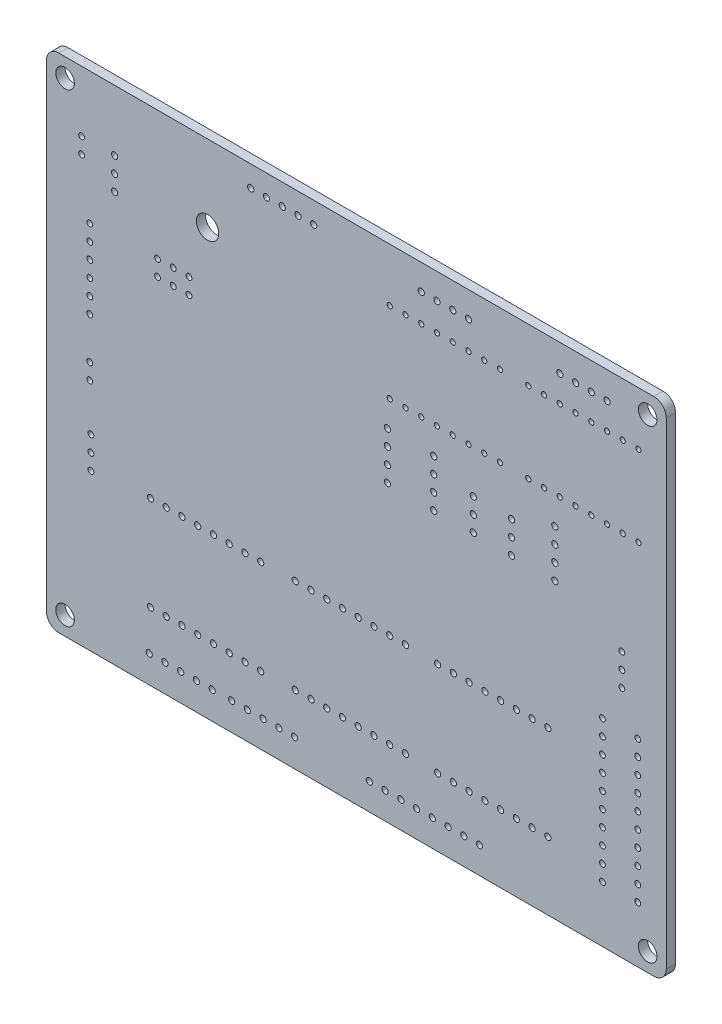
from build123d import *

# Parameters (mm, degrees)
SKETCH2_R           = 1.5
SKETCH2_R_2         = 1.8034
SKETCH2_R_3         = 0.5
SKETCH2_R_4         = 0.4699
SKETCH2_R_5         = 0.498751149
SKETCH2_R_6         = 0.4191
SKETCH2_R_7         = 0.501468592
BOSS_EXTRUDE1_DEPTH = 0.75


with BuildPart() as part:
    # Sketch2 → Boss-Extrude1 (new, symmetric)
    with BuildSketch(Plane.XY):
        with BuildLine():
            Line((0, 2), (0, 79))
            ThreePointArc((0, 79), (0.5858, 80.4142), (2, 81))
            Line((2, 81), (98, 81))
            ThreePointArc((98, 81), (99.4142, 80.4142), (100, 79))
            Line((100, 79), (100, 2))
            ThreePointArc((100, 2), (99.4142, 0.5858), (98, 0))
            Line((98, 0), (2, 0))
            ThreePointArc((2, 0), (0.5858, 0.5858), (0, 2))
        make_face()
        with Locations((97, 3)):
            Circle(SKETCH2_R, mode=Mode.SUBTRACT)
        with Locations((3, 3)):
            Circle(SKETCH2_R, mode=Mode.SUBTRACT)
        with Locations((3, 78)):
            Circle(SKETCH2_R, mode=Mode.SUBTRACT)
        with Locations((97, 78)):
            Circle(SKETCH2_R, mode=Mode.SUBTRACT)
        with Locations((25.985, 68.6444)):
            Circle(SKETCH2_R_2, mode=Mode.SUBTRACT)
        with Locations((10.999, 68.6444)):
            Circle(SKETCH2_R_3, mode=Mode.SUBTRACT)
        with Locations((10.999, 66.1044)):
            Circle(SKETCH2_R_3, mode=Mode.SUBTRACT)
        with Locations((32.9608, 77.5942)):
            Circle(SKETCH2_R_3, mode=Mode.SUBTRACT)
        with Locations((35.5008, 77.5942)):
            Circle(SKETCH2_R_3, mode=Mode.SUBTRACT)
        with Locations((38.0408, 77.5942)):
            Circle(SKETCH2_R_3, mode=Mode.SUBTRACT)
        with Locations((5.667, 71.2098)):
            Circle(SKETCH2_R_4, mode=Mode.SUBTRACT)
        with Locations((5.667, 68.6698)):
            Circle(SKETCH2_R_4, mode=Mode.SUBTRACT)
        with Locations((7, 59.7)):
            Circle(SKETCH2_R_4, mode=Mode.SUBTRACT)
        with Locations((7, 57.16)):
            Circle(SKETCH2_R_4, mode=Mode.SUBTRACT)
        with Locations((7, 54.62)):
            Circle(SKETCH2_R_4, mode=Mode.SUBTRACT)
        with Locations((7, 52.08)):
            Circle(SKETCH2_R_4, mode=Mode.SUBTRACT)
        with Locations((7, 49.54)):
            Circle(SKETCH2_R_4, mode=Mode.SUBTRACT)
        with Locations((7, 47)):
            Circle(SKETCH2_R_4, mode=Mode.SUBTRACT)
        with Locations((6.999, 40.307)):
            Circle(SKETCH2_R_4, mode=Mode.SUBTRACT)
        with Locations((6.999, 37.767)):
            Circle(SKETCH2_R_4, mode=Mode.SUBTRACT)
        with Locations((7.178, 30.305)):
            Circle(SKETCH2_R_4, mode=Mode.SUBTRACT)
        with Locations((7.178, 27.765)):
            Circle(SKETCH2_R_4, mode=Mode.SUBTRACT)
        with Locations((7.178, 25.225)):
            Circle(SKETCH2_R_4, mode=Mode.SUBTRACT)
        with Locations((17.92, 60.238)):
            Circle(SKETCH2_R_4, mode=Mode.SUBTRACT)
        with Locations((20.46, 60.238)):
            Circle(SKETCH2_R_4, mode=Mode.SUBTRACT)
        with Locations((23, 60.238)):
            Circle(SKETCH2_R_4, mode=Mode.SUBTRACT)
        with Locations((17.92, 57.698)):
            Circle(SKETCH2_R_4, mode=Mode.SUBTRACT)
        with Locations((20.46, 57.698)):
            Circle(SKETCH2_R_4, mode=Mode.SUBTRACT)
        with Locations((23, 57.698)):
            Circle(SKETCH2_R_4, mode=Mode.SUBTRACT)
        with Locations((10.999, 71.1844)):
            Circle(SKETCH2_R_5, mode=Mode.SUBTRACT)
        with Locations((40.5808, 77.5942)):
            Circle(SKETCH2_R_3, mode=Mode.SUBTRACT)
        with Locations((43.1208, 77.5942)):
            Circle(SKETCH2_R_3, mode=Mode.SUBTRACT)
        with Locations((60.4696, 76.883)):
            Circle(SKETCH2_R_3, mode=Mode.SUBTRACT)
        with Locations((63.0096, 76.883)):
            Circle(SKETCH2_R_3, mode=Mode.SUBTRACT)
        with Locations((65.5496, 76.883)):
            Circle(SKETCH2_R_3, mode=Mode.SUBTRACT)
        with Locations((68.0896, 76.883)):
            Circle(SKETCH2_R_3, mode=Mode.SUBTRACT)
        with Locations((82.8285, 76.629)):
            Circle(SKETCH2_R_3, mode=Mode.SUBTRACT)
        with Locations((85.3685, 76.629)):
            Circle(SKETCH2_R_3, mode=Mode.SUBTRACT)
        with Locations((87.9085, 76.629)):
            Circle(SKETCH2_R_3, mode=Mode.SUBTRACT)
        with Locations((90.4485, 76.629)):
            Circle(SKETCH2_R_3, mode=Mode.SUBTRACT)
        with Locations((55.389, 72.405)):
            Circle(SKETCH2_R_6, mode=Mode.SUBTRACT)
        with Locations((57.929, 72.405)):
            Circle(SKETCH2_R_6, mode=Mode.SUBTRACT)
        with Locations((60.469, 72.405)):
            Circle(SKETCH2_R_6, mode=Mode.SUBTRACT)
        with Locations((63.009, 72.405)):
            Circle(SKETCH2_R_6, mode=Mode.SUBTRACT)
        with Locations((65.549, 72.405)):
            Circle(SKETCH2_R_6, mode=Mode.SUBTRACT)
        with Locations((68.089, 72.405)):
            Circle(SKETCH2_R_6, mode=Mode.SUBTRACT)
        with Locations((70.629, 72.405)):
            Circle(SKETCH2_R_6, mode=Mode.SUBTRACT)
        with Locations((73.169, 72.405)):
            Circle(SKETCH2_R_6, mode=Mode.SUBTRACT)
        with Locations((77.741, 72.405)):
            Circle(SKETCH2_R_6, mode=Mode.SUBTRACT)
        with Locations((80.281, 72.405)):
            Circle(SKETCH2_R_6, mode=Mode.SUBTRACT)
        with Locations((82.821, 72.405)):
            Circle(SKETCH2_R_6, mode=Mode.SUBTRACT)
        with Locations((85.361, 72.405)):
            Circle(SKETCH2_R_6, mode=Mode.SUBTRACT)
        with Locations((87.901, 72.405)):
            Circle(SKETCH2_R_6, mode=Mode.SUBTRACT)
        with Locations((90.441, 72.405)):
            Circle(SKETCH2_R_6, mode=Mode.SUBTRACT)
        with Locations((92.981, 72.405)):
            Circle(SKETCH2_R_6, mode=Mode.SUBTRACT)
        with Locations((95.521, 72.405)):
            Circle(SKETCH2_R_6, mode=Mode.SUBTRACT)
        with Locations((55.389, 59.405)):
            Circle(SKETCH2_R_6, mode=Mode.SUBTRACT)
        with Locations((57.929, 59.405)):
            Circle(SKETCH2_R_6, mode=Mode.SUBTRACT)
        with Locations((60.469, 59.405)):
            Circle(SKETCH2_R_6, mode=Mode.SUBTRACT)
        with Locations((63.009, 59.405)):
            Circle(SKETCH2_R_6, mode=Mode.SUBTRACT)
        with Locations((65.549, 59.405)):
            Circle(SKETCH2_R_6, mode=Mode.SUBTRACT)
        with Locations((68.089, 59.405)):
            Circle(SKETCH2_R_6, mode=Mode.SUBTRACT)
        with Locations((70.629, 59.405)):
            Circle(SKETCH2_R_6, mode=Mode.SUBTRACT)
        with Locations((73.169, 59.405)):
            Circle(SKETCH2_R_6, mode=Mode.SUBTRACT)
        with Locations((77.741, 59.405)):
            Circle(SKETCH2_R_6, mode=Mode.SUBTRACT)
        with Locations((80.281, 59.405)):
            Circle(SKETCH2_R_6, mode=Mode.SUBTRACT)
        with Locations((82.821, 59.405)):
            Circle(SKETCH2_R_6, mode=Mode.SUBTRACT)
        with Locations((85.361, 59.405)):
            Circle(SKETCH2_R_6, mode=Mode.SUBTRACT)
        with Locations((87.901, 59.405)):
            Circle(SKETCH2_R_6, mode=Mode.SUBTRACT)
        with Locations((90.441, 59.405)):
            Circle(SKETCH2_R_6, mode=Mode.SUBTRACT)
        with Locations((92.981, 59.405)):
            Circle(SKETCH2_R_6, mode=Mode.SUBTRACT)
        with Locations((95.521, 59.405)):
            Circle(SKETCH2_R_6, mode=Mode.SUBTRACT)
        with Locations((55.017, 55.072)):
            Circle(SKETCH2_R_3, mode=Mode.SUBTRACT)
        with Locations((55.017, 52.532)):
            Circle(SKETCH2_R_3, mode=Mode.SUBTRACT)
        with Locations((55.017, 49.992)):
            Circle(SKETCH2_R_7, mode=Mode.SUBTRACT)
        with Locations((55.017, 47.452)):
            Circle(SKETCH2_R_3, mode=Mode.SUBTRACT)
        with Locations((62.48, 54.945)):
            Circle(SKETCH2_R_3, mode=Mode.SUBTRACT)
        with Locations((62.48, 52.405)):
            Circle(SKETCH2_R_3, mode=Mode.SUBTRACT)
        with Locations((62.48, 49.865)):
            Circle(SKETCH2_R_3, mode=Mode.SUBTRACT)
        with Locations((62.48, 47.325)):
            Circle(SKETCH2_R_3, mode=Mode.SUBTRACT)
        with Locations((68.872, 52.504)):
            Circle(SKETCH2_R_3, mode=Mode.SUBTRACT)
        with Locations((68.872, 49.964)):
            Circle(SKETCH2_R_3, mode=Mode.SUBTRACT)
        with Locations((68.872, 47.424)):
            Circle(SKETCH2_R_3, mode=Mode.SUBTRACT)
        with Locations((75.034, 52.405)):
            Circle(SKETCH2_R_3, mode=Mode.SUBTRACT)
        with Locations((75.034, 49.865)):
            Circle(SKETCH2_R_3, mode=Mode.SUBTRACT)
        with Locations((75.034, 47.325)):
            Circle(SKETCH2_R_3, mode=Mode.SUBTRACT)
        with Locations((82.022, 52.359)):
            Circle(SKETCH2_R_3, mode=Mode.SUBTRACT)
        with Locations((82.022, 54.899)):
            Circle(SKETCH2_R_3, mode=Mode.SUBTRACT)
        with Locations((82.022, 49.819)):
            Circle(SKETCH2_R_3, mode=Mode.SUBTRACT)
        with Locations((82.022, 47.279)):
            Circle(SKETCH2_R_3, mode=Mode.SUBTRACT)
        with Locations((92.837, 42.799)):
            Circle(SKETCH2_R_4, mode=Mode.SUBTRACT)
        with Locations((92.837, 40.259)):
            Circle(SKETCH2_R_4, mode=Mode.SUBTRACT)
        with Locations((92.837, 37.719)):
            Circle(SKETCH2_R_4, mode=Mode.SUBTRACT)
        with Locations((89.709, 31.912)):
            Circle(SKETCH2_R_4, mode=Mode.SUBTRACT)
        with Locations((89.709, 29.372)):
            Circle(SKETCH2_R_4, mode=Mode.SUBTRACT)
        with Locations((89.709, 26.832)):
            Circle(SKETCH2_R_4, mode=Mode.SUBTRACT)
        with Locations((89.709, 24.292)):
            Circle(SKETCH2_R_4, mode=Mode.SUBTRACT)
        with Locations((89.709, 21.752)):
            Circle(SKETCH2_R_4, mode=Mode.SUBTRACT)
        with Locations((89.709, 19.212)):
            Circle(SKETCH2_R_4, mode=Mode.SUBTRACT)
        with Locations((89.709, 16.672)):
            Circle(SKETCH2_R_4, mode=Mode.SUBTRACT)
        with Locations((89.709, 14.132)):
            Circle(SKETCH2_R_4, mode=Mode.SUBTRACT)
        with Locations((89.709, 11.592)):
            Circle(SKETCH2_R_4, mode=Mode.SUBTRACT)
        with Locations((89.709, 9.052)):
            Circle(SKETCH2_R_4, mode=Mode.SUBTRACT)
        with Locations((95.407, 9.052)):
            Circle(SKETCH2_R_4, mode=Mode.SUBTRACT)
        with Locations((95.407, 11.592)):
            Circle(SKETCH2_R_4, mode=Mode.SUBTRACT)
        with Locations((95.407, 14.132)):
            Circle(SKETCH2_R_4, mode=Mode.SUBTRACT)
        with Locations((95.407, 16.672)):
            Circle(SKETCH2_R_4, mode=Mode.SUBTRACT)
        with Locations((95.407, 19.212)):
            Circle(SKETCH2_R_4, mode=Mode.SUBTRACT)
        with Locations((95.407, 21.752)):
            Circle(SKETCH2_R_4, mode=Mode.SUBTRACT)
        with Locations((95.407, 24.292)):
            Circle(SKETCH2_R_4, mode=Mode.SUBTRACT)
        with Locations((95.407, 26.832)):
            Circle(SKETCH2_R_4, mode=Mode.SUBTRACT)
        with Locations((95.407, 29.372)):
            Circle(SKETCH2_R_4, mode=Mode.SUBTRACT)
        with Locations((95.407, 31.912)):
            Circle(SKETCH2_R_4, mode=Mode.SUBTRACT)
        with Locations((16.784, 26.187)):
            Circle(SKETCH2_R_3, mode=Mode.SUBTRACT)
        with Locations((19.324, 26.187)):
            Circle(SKETCH2_R_3, mode=Mode.SUBTRACT)
        with Locations((21.864, 26.187)):
            Circle(SKETCH2_R_3, mode=Mode.SUBTRACT)
        with Locations((24.404, 26.187)):
            Circle(SKETCH2_R_3, mode=Mode.SUBTRACT)
        with Locations((26.944, 26.187)):
            Circle(SKETCH2_R_3, mode=Mode.SUBTRACT)
        with Locations((29.484, 26.187)):
            Circle(SKETCH2_R_3, mode=Mode.SUBTRACT)
        with Locations((32.024, 26.187)):
            Circle(SKETCH2_R_3, mode=Mode.SUBTRACT)
        with Locations((34.564, 26.187)):
            Circle(SKETCH2_R_3, mode=Mode.SUBTRACT)
        with Locations((16.784, 10.947)):
            Circle(SKETCH2_R_3, mode=Mode.SUBTRACT)
        with Locations((19.324, 10.947)):
            Circle(SKETCH2_R_3, mode=Mode.SUBTRACT)
        with Locations((21.864, 10.947)):
            Circle(SKETCH2_R_3, mode=Mode.SUBTRACT)
        with Locations((24.404, 10.947)):
            Circle(SKETCH2_R_3, mode=Mode.SUBTRACT)
        with Locations((26.944, 10.947)):
            Circle(SKETCH2_R_3, mode=Mode.SUBTRACT)
        with Locations((29.484, 10.947)):
            Circle(SKETCH2_R_3, mode=Mode.SUBTRACT)
        with Locations((32.024, 10.947)):
            Circle(SKETCH2_R_3, mode=Mode.SUBTRACT)
        with Locations((34.564, 10.947)):
            Circle(SKETCH2_R_3, mode=Mode.SUBTRACT)
        with Locations((40.139, 26.314)):
            Circle(SKETCH2_R_3, mode=Mode.SUBTRACT)
        with Locations((42.679, 26.314)):
            Circle(SKETCH2_R_3, mode=Mode.SUBTRACT)
        with Locations((45.219, 26.314)):
            Circle(SKETCH2_R_3, mode=Mode.SUBTRACT)
        with Locations((47.759, 26.314)):
            Circle(SKETCH2_R_3, mode=Mode.SUBTRACT)
        with Locations((50.299, 26.314)):
            Circle(SKETCH2_R_3, mode=Mode.SUBTRACT)
        with Locations((52.839, 26.314)):
            Circle(SKETCH2_R_3, mode=Mode.SUBTRACT)
        with Locations((55.379, 26.314)):
            Circle(SKETCH2_R_3, mode=Mode.SUBTRACT)
        with Locations((57.919, 26.314)):
            Circle(SKETCH2_R_3, mode=Mode.SUBTRACT)
        with Locations((63.113, 26.187)):
            Circle(SKETCH2_R_3, mode=Mode.SUBTRACT)
        with Locations((65.653, 26.187)):
            Circle(SKETCH2_R_3, mode=Mode.SUBTRACT)
        with Locations((68.193, 26.187)):
            Circle(SKETCH2_R_3, mode=Mode.SUBTRACT)
        with Locations((70.733, 26.187)):
            Circle(SKETCH2_R_3, mode=Mode.SUBTRACT)
        with Locations((73.273, 26.187)):
            Circle(SKETCH2_R_3, mode=Mode.SUBTRACT)
        with Locations((75.813, 26.187)):
            Circle(SKETCH2_R_3, mode=Mode.SUBTRACT)
        with Locations((78.353, 26.187)):
            Circle(SKETCH2_R_3, mode=Mode.SUBTRACT)
        with Locations((80.893, 26.187)):
            Circle(SKETCH2_R_3, mode=Mode.SUBTRACT)
        with Locations((40.139, 11.074)):
            Circle(SKETCH2_R_3, mode=Mode.SUBTRACT)
        with Locations((42.679, 11.074)):
            Circle(SKETCH2_R_3, mode=Mode.SUBTRACT)
        with Locations((45.219, 11.074)):
            Circle(SKETCH2_R_3, mode=Mode.SUBTRACT)
        with Locations((47.759, 11.074)):
            Circle(SKETCH2_R_3, mode=Mode.SUBTRACT)
        with Locations((50.299, 11.074)):
            Circle(SKETCH2_R_3, mode=Mode.SUBTRACT)
        with Locations((52.839, 11.074)):
            Circle(SKETCH2_R_3, mode=Mode.SUBTRACT)
        with Locations((55.379, 11.074)):
            Circle(SKETCH2_R_3, mode=Mode.SUBTRACT)
        with Locations((57.919, 11.074)):
            Circle(SKETCH2_R_3, mode=Mode.SUBTRACT)
        with Locations((63.113, 10.947)):
            Circle(SKETCH2_R_3, mode=Mode.SUBTRACT)
        with Locations((65.653, 10.947)):
            Circle(SKETCH2_R_3, mode=Mode.SUBTRACT)
        with Locations((68.193, 10.947)):
            Circle(SKETCH2_R_3, mode=Mode.SUBTRACT)
        with Locations((70.733, 10.947)):
            Circle(SKETCH2_R_3, mode=Mode.SUBTRACT)
        with Locations((73.273, 10.947)):
            Circle(SKETCH2_R_3, mode=Mode.SUBTRACT)
        with Locations((75.813, 10.947)):
            Circle(SKETCH2_R_3, mode=Mode.SUBTRACT)
        with Locations((78.353, 10.947)):
            Circle(SKETCH2_R_3, mode=Mode.SUBTRACT)
        with Locations((80.893, 10.947)):
            Circle(SKETCH2_R_3, mode=Mode.SUBTRACT)
        with Locations((16.58, 4.423)):
            Circle(SKETCH2_R_3, mode=Mode.SUBTRACT)
        with Locations((19.12, 4.423)):
            Circle(SKETCH2_R_3, mode=Mode.SUBTRACT)
        with Locations((21.66, 4.423)):
            Circle(SKETCH2_R_3, mode=Mode.SUBTRACT)
        with Locations((24.2, 4.423)):
            Circle(SKETCH2_R_3, mode=Mode.SUBTRACT)
        with Locations((26.74, 4.423)):
            Circle(SKETCH2_R_3, mode=Mode.SUBTRACT)
        with Locations((29.873, 4.467)):
            Circle(SKETCH2_R_3, mode=Mode.SUBTRACT)
        with Locations((32.413, 4.467)):
            Circle(SKETCH2_R_3, mode=Mode.SUBTRACT)
        with Locations((34.953, 4.467)):
            Circle(SKETCH2_R_3, mode=Mode.SUBTRACT)
        with Locations((37.493, 4.467)):
            Circle(SKETCH2_R_3, mode=Mode.SUBTRACT)
        with Locations((40.033, 4.467)):
            Circle(SKETCH2_R_3, mode=Mode.SUBTRACT)
        with Locations((52.095, 4.296)):
            Circle(SKETCH2_R_3, mode=Mode.SUBTRACT)
        with Locations((54.635, 4.296)):
            Circle(SKETCH2_R_3, mode=Mode.SUBTRACT)
        with Locations((57.175, 4.296)):
            Circle(SKETCH2_R_3, mode=Mode.SUBTRACT)
        with Locations((59.715, 4.296)):
            Circle(SKETCH2_R_3, mode=Mode.SUBTRACT)
        with Locations((62.255, 4.296)):
            Circle(SKETCH2_R_3, mode=Mode.SUBTRACT)
        with Locations((64.795, 4.296)):
            Circle(SKETCH2_R_3, mode=Mode.SUBTRACT)
        with Locations((67.335, 4.296)):
            Circle(SKETCH2_R_3, mode=Mode.SUBTRACT)
        with Locations((69.875, 4.296)):
            Circle(SKETCH2_R_3, mode=Mode.SUBTRACT)
    extrude(amount=BOSS_EXTRUDE1_DEPTH, both=True)


solid = part.part
